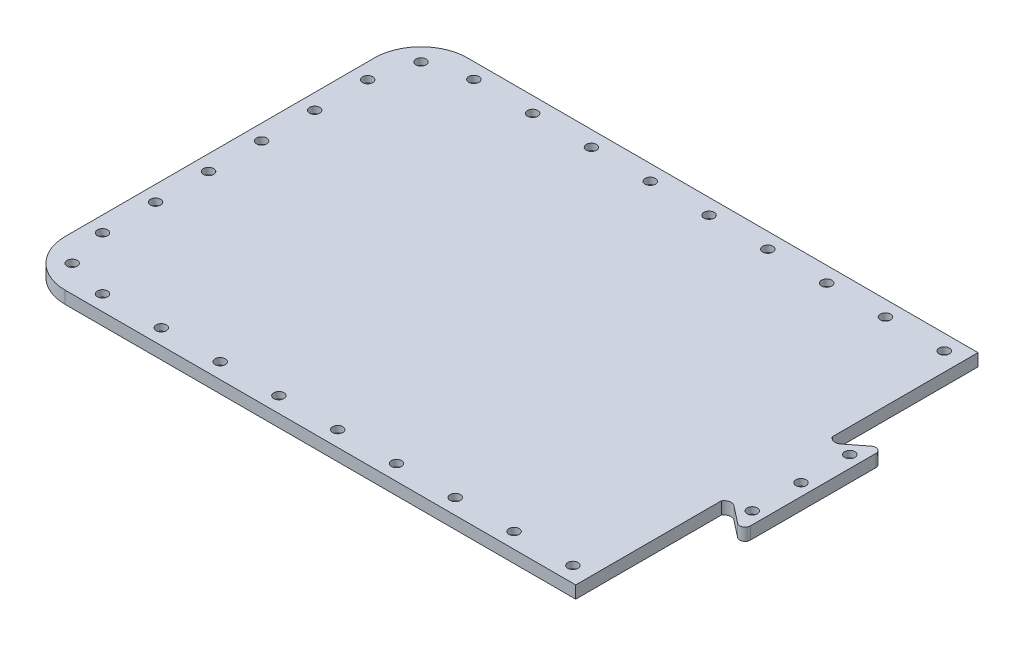
from build123d import *

# Parameters (mm, degrees)
EXTRUDE_1_DEPTH     = 4
SKETCH_5_R          = 1.65
CUT_EXTRUDE_1_DEPTH = 2.1


with BuildPart() as part:
    # 草图1 → 凸台-拉伸1 (new body)
    with BuildSketch(Plane(origin=(0, 0, 0), x_dir=(1, 0, 0), z_dir=(0, 1, 0))):
        with BuildLine():
            Line((85.982202548, 23.730183562), (80.444848449, 19.403928396))
            ThreePointArc((80.444848449, 19.403928396), (78.581927501, 18.960188067), (77.028827056, 20.08057146))
            Line((77.028827056, 20.08057146), (77.028827056, 67.115745446))
            Line((77.028827056, 67.115745446), (-87.971172944, 67.115745446))
            ThreePointArc((-87.971172944, 67.115745446), (-98.577774662, 62.722347164), (-102.971172944, 52.115745446))
            Line((-102.971172944, 52.115745446), (-102.971172944, -47.884254554))
            ThreePointArc((-102.971172944, -47.884254554), (-98.577774662, -58.490856271), (-87.971172944, -62.884254554))
            Line((-87.971172944, -62.884254554), (77.028827056, -62.884254554))
            Line((77.028827056, -62.884254554), (77.028827056, -15.849080568))
            ThreePointArc((77.028827056, -15.849080568), (78.581927501, -14.728697175), (80.444848449, -15.172437504))
            Line((80.444848449, -15.172437504), (85.982202548, -19.49869267))
            ThreePointArc((85.982202548, -19.49869267), (87.774058006, -19.687024267), (88.728827056, -18.159074389))
            Line((88.728827056, -18.159074389), (88.728827056, 22.390565281))
            ThreePointArc((88.728827056, 22.390565281), (87.774058006, 23.91851516), (85.982202548, 23.730183562))
        make_face()
    extrude(amount=EXTRUDE_1_DEPTH)

    # 草图5 → 切除-拉伸1 (cut)
    with BuildSketch(Plane(origin=(0, 4, 0), x_dir=(1, 0, 0), z_dir=(0, 1, 0))):
        with Locations((84.828827056, -13.648405937)):
            Circle(SKETCH_5_R)
        with Locations((84.828827056, 2.115745446)):
            Circle(SKETCH_5_R)
        with Locations((84.828827056, 17.87989683)):
            Circle(SKETCH_5_R)
        with Locations((71.11417076, 62.115745446)):
            Circle(SKETCH_5_R)
        with Locations((52.11417076, 62.115745446)):
            Circle(SKETCH_5_R)
        with Locations((33.11417076, 62.115745446)):
            Circle(SKETCH_5_R)
        with Locations((14.11417076, 62.115745446)):
            Circle(SKETCH_5_R)
        with Locations((-4.88582924, 62.115745446)):
            Circle(SKETCH_5_R)
        with Locations((-23.88582924, 62.115745446)):
            Circle(SKETCH_5_R)
        with Locations((-42.88582924, 62.115745446)):
            Circle(SKETCH_5_R)
        with Locations((-61.88582924, 62.115745446)):
            Circle(SKETCH_5_R)
        with Locations((-80.88582924, 62.115745446)):
            Circle(SKETCH_5_R)
        with Locations((-94.335133975, 58.479706477)):
            Circle(SKETCH_5_R)
        with Locations((-97.971172944, 44.88442265)):
            Circle(SKETCH_5_R)
        with Locations((-97.971172944, 27.74775595)):
            Circle(SKETCH_5_R)
        with Locations((-97.971172944, 10.61108925)):
            Circle(SKETCH_5_R)
        with Locations((-97.971172944, -6.52557745)):
            Circle(SKETCH_5_R)
        with Locations((-97.971172944, -23.66224415)):
            Circle(SKETCH_5_R)
        with Locations((-97.971172944, -40.79891085)):
            Circle(SKETCH_5_R)
        with Locations((-94.335133975, -54.248215584)):
            Circle(SKETCH_5_R)
        with Locations((-80.88582924, -57.884254554)):
            Circle(SKETCH_5_R)
        with Locations((-61.88582924, -57.884254554)):
            Circle(SKETCH_5_R)
        with Locations((-42.88582924, -57.884254554)):
            Circle(SKETCH_5_R)
        with Locations((-23.88582924, -57.884254554)):
            Circle(SKETCH_5_R)
        with Locations((-4.88582924, -57.884254554)):
            Circle(SKETCH_5_R)
        with Locations((14.11417076, -57.884254554)):
            Circle(SKETCH_5_R)
        with Locations((33.11417076, -57.884254554)):
            Circle(SKETCH_5_R)
        with Locations((52.11417076, -57.884254554)):
            Circle(SKETCH_5_R)
        with Locations((71.11417076, -57.884254554)):
            Circle(SKETCH_5_R)
    extrude(amount=-CUT_EXTRUDE_1_DEPTH, mode=Mode.SUBTRACT)


solid = part.part
